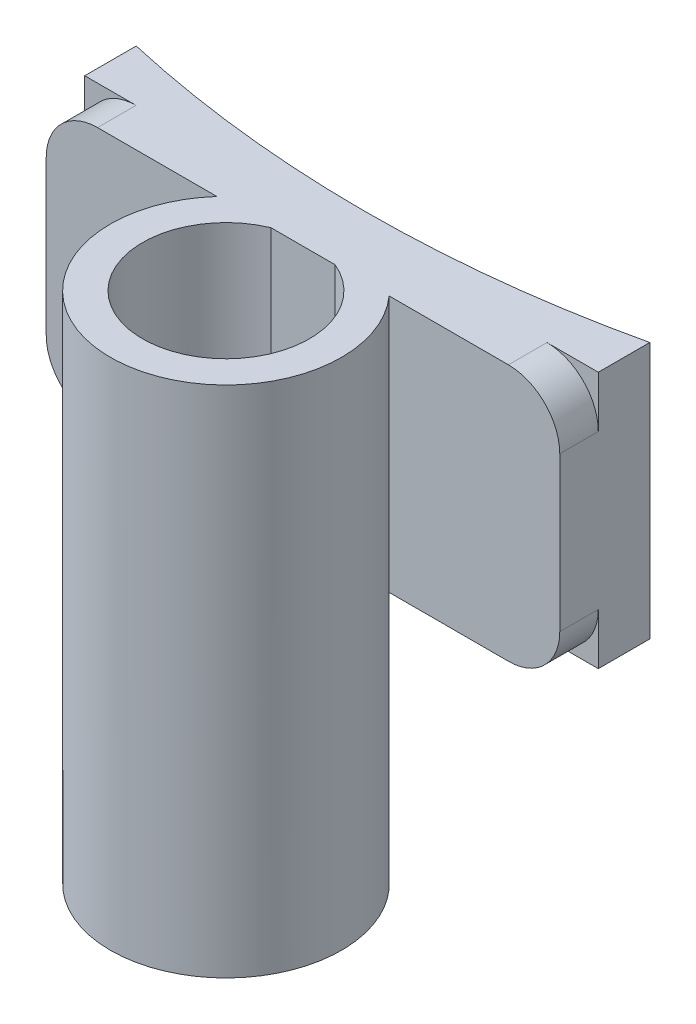
from build123d import *

# Parameters (mm, degrees)
SKETCH1_R           = 4.5
SKETCH1_R_2         = 3.25
BOSS_EXTRUDE1_DEPTH = 20
SKETCH2_W           = 20
SKETCH2_H           = 10
BOSS_EXTRUDE2_DEPTH = 1.5
FILLET1_R           = 2
SKETCH2_4_W         = 20
SKETCH2_4_H         = 10
SKETCH2_4_R         = 2
BOSS_EXTRUDE3_DEPTH = 3
SKETCH4_R           = 45
CUT_EXTRUDE1_DEPTH  = 10


with BuildPart() as part:
    # Sketch1 → Boss-Extrude1 (new body)
    with BuildSketch(Plane(origin=(0, 0, 0), x_dir=(1, 0, 0), z_dir=(0, 1, 0))):
        Circle(SKETCH1_R)
        Circle(SKETCH1_R_2, mode=Mode.SUBTRACT)
    extrude(amount=BOSS_EXTRUDE1_DEPTH)

    # Sketch2 → Boss-Extrude2 (add, symmetric)
    with BuildSketch(Plane.XY.offset(-4.5)):
        with Locations((0, 15)):
            Rectangle(SKETCH2_W, SKETCH2_H)
    extrude(amount=BOSS_EXTRUDE2_DEPTH, both=True)

    # Fillet1
    fillet1_edges = [part.edges().sort_by_distance(p)[0] for p in [
        (-10, 10, -4.5),
        (-10, 20, -4.5),
        (10, 10, -4.5),
        (10, 20, -4.5),
    ]]
    fillet(fillet1_edges, radius=FILLET1_R)

    # Sketch2<4> → Boss-Extrude3 (add)
    with BuildSketch(Plane.XY.offset(-4.5)):
        with Locations((0, 15)):
            Rectangle(SKETCH2_4_W, SKETCH2_4_H)
        with Locations((-7.25, 15)):
            Circle(SKETCH2_4_R, mode=Mode.SUBTRACT)
        with Locations((7.25, 15)):
            Circle(SKETCH2_4_R, mode=Mode.SUBTRACT)
    extrude(amount=-BOSS_EXTRUDE3_DEPTH)

    # Sketch4 → Cut-Extrude1 (cut)
    with BuildSketch(Plane(origin=(0, 20, 0), x_dir=(1, 0, 0), z_dir=(0, 1, 0))):
        with Locations((0, 50.37974859)):
            Circle(SKETCH4_R)
    extrude(amount=-CUT_EXTRUDE1_DEPTH, mode=Mode.SUBTRACT)


solid = part.part
